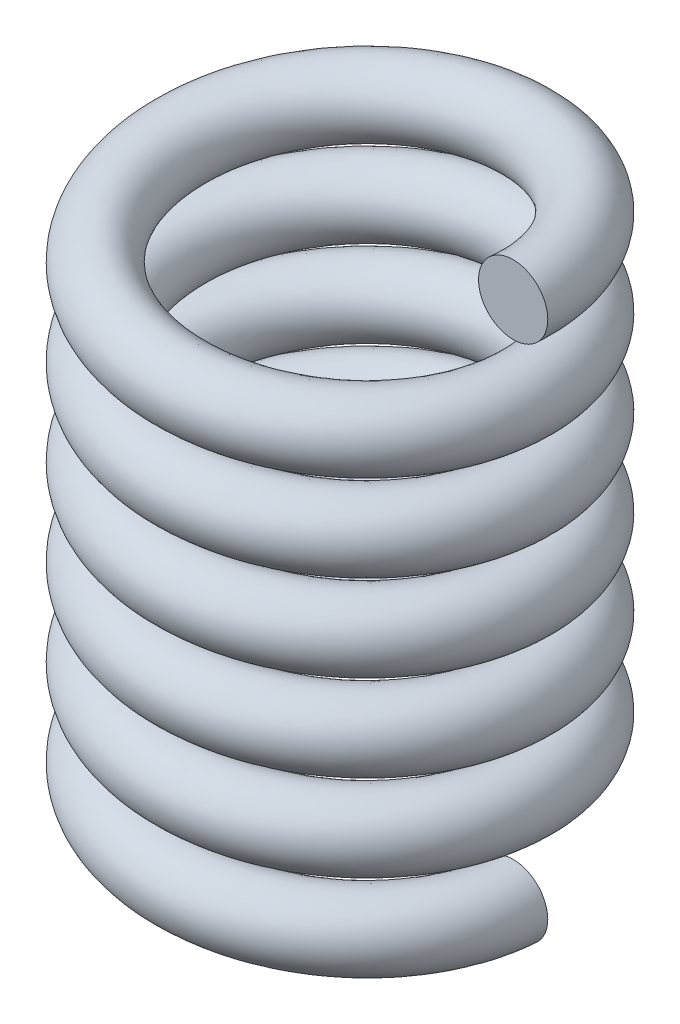
from build123d import *

# Parameters (mm, degrees)
SWEEP_1_PITCH       = 5
SWEEP_1_HEIGHT      = 30
SWEEP_1_RADIUS      = 10
SWEEP_1_START_ANGLE = 90
SKETCH_2_R          = 2


with BuildPart() as part:
    # 掃出1: sweep along a helix
    with BuildLine() as sweep_1_path:
        add(Helix(SWEEP_1_PITCH, SWEEP_1_HEIGHT, SWEEP_1_RADIUS, center=(0, 0, 0), direction=(0, 1, 0), lefthand=True, mode=Mode.PRIVATE).rotate(Axis((0, 0, 0), (0, 1, 0)), SWEEP_1_START_ANGLE))
    # 草圖2 → 掃出1 (sweep)
    with BuildSketch(Plane.XY):
        with Locations((10, 0)):
            Circle(SKETCH_2_R)
    sweep(path=sweep_1_path.line, is_frenet=True)


solid = part.part
